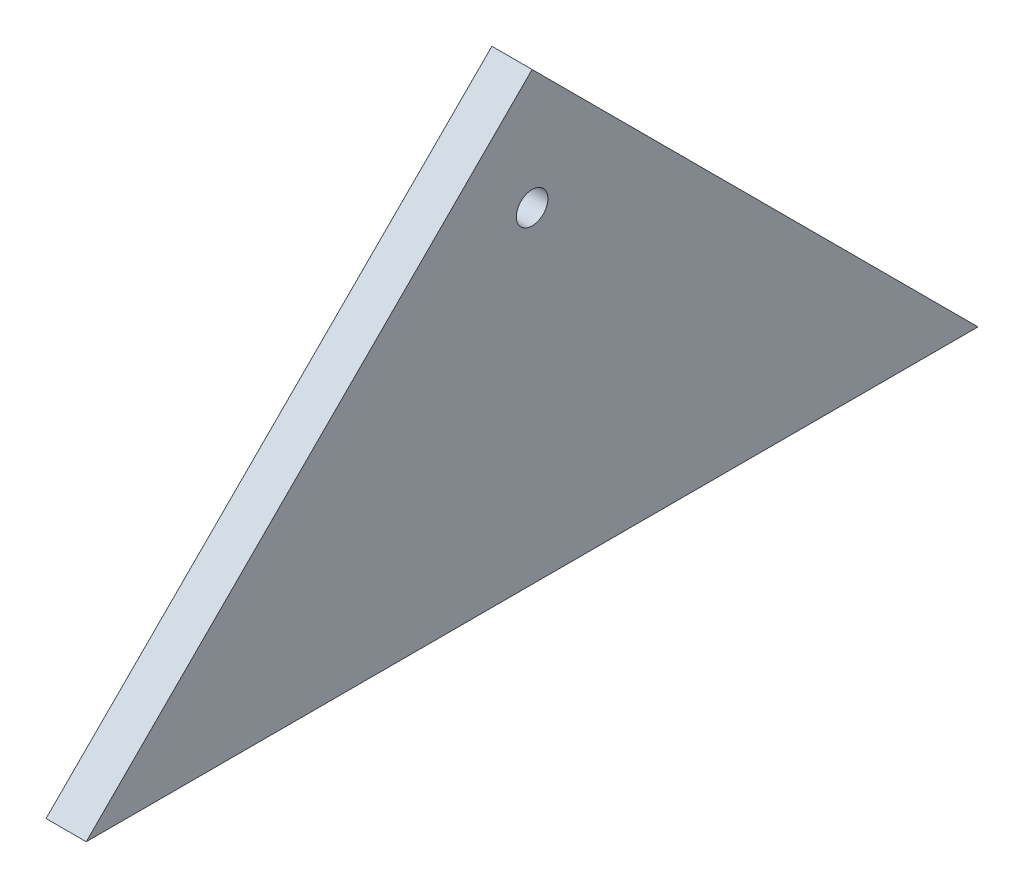
from build123d import *

# Parameters (mm, degrees)
SKETCH1_R           = 4.7625
BOSS_EXTRUDE1_DEPTH = 12.1539


with BuildPart() as part:
    # Sketch1 → Boss-Extrude1 (new body)
    with BuildSketch(Plane(origin=(0, 0, 0), x_dir=(0, 0, -1), z_dir=(1, 0, 0))):
        Polygon((0, 36.1696), (-134.703841816, -98.534241816), (134.703841816, -98.534241816), align=None)
        Circle(SKETCH1_R, mode=Mode.SUBTRACT)
    extrude(amount=BOSS_EXTRUDE1_DEPTH)


solid = part.part
